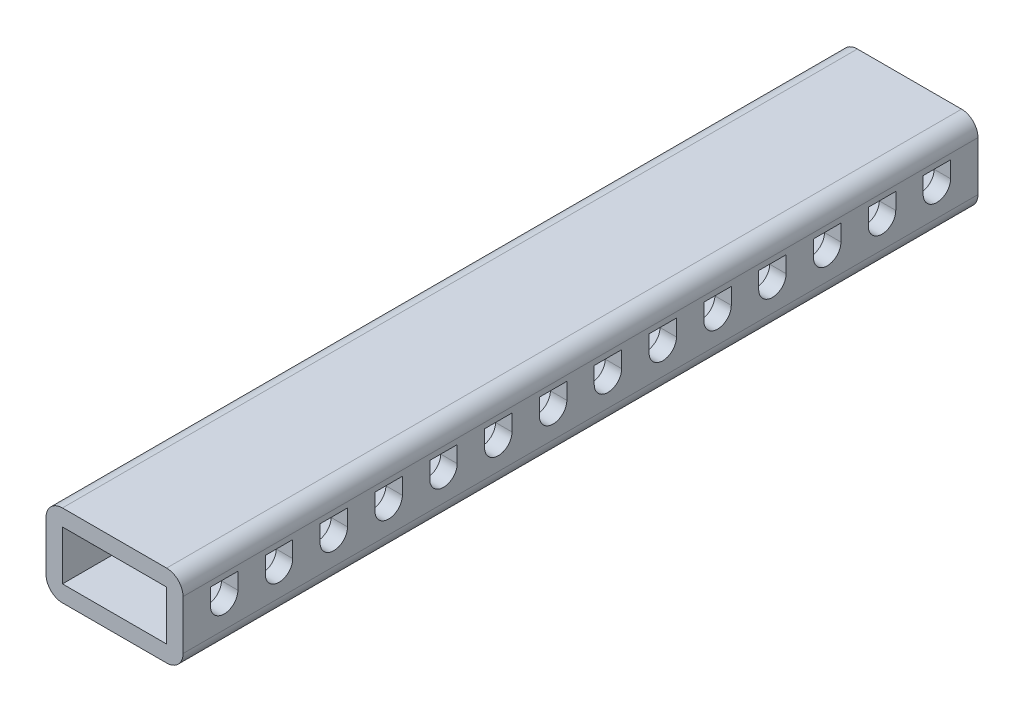
from build123d import *

# Parameters (mm, degrees)
SKETCH1_W           = 25
SKETCH1_H           = 15
BOSS_EXTRUDE1_DEPTH = 145
SKETCH2_W           = 19
SKETCH2_H           = 9
CUT_EXTRUDE1_DEPTH  = 263
CUT_EXTRUDE2_DEPTH  = 263
FILLET1_R           = 3


with BuildPart() as part:
    # Sketch1 → Boss-Extrude1 (new body)
    with BuildSketch(Plane.XY):
        Rectangle(SKETCH1_W, SKETCH1_H)
    extrude(amount=BOSS_EXTRUDE1_DEPTH)

    # Sketch2 → Cut-Extrude1 (cut)
    with BuildSketch(Plane.XY.offset(145)):
        Rectangle(SKETCH2_W, SKETCH2_H)
    extrude(amount=-CUT_EXTRUDE1_DEPTH, mode=Mode.SUBTRACT)

    # Sketch3 → Cut-Extrude2 (cut)
    with BuildSketch(Plane(origin=(12.5, 0, 0), x_dir=(0, 0, -1), z_dir=(1, 0, 0))):
        with BuildLine():
            Line((-140, 3.5), (-140, 0.5))
            ThreePointArc((-140, 0.5), (-137.5, -2), (-135, 0.5))
            Line((-135, 0.5), (-135, 3.5))
            Line((-135, 3.5), (-140, 3.5))
        make_face()
        with BuildLine():
            ThreePointArc((-125, 0.5), (-127.5, -2), (-130, 0.5))
            Line((-130, 0.5), (-130, 3.5))
            Line((-130, 3.5), (-125, 3.5))
            Line((-125, 3.5), (-125, 0.5))
        make_face()
        with BuildLine():
            Line((-120, 3.5), (-120, 0.5))
            ThreePointArc((-120, 0.5), (-117.5, -2), (-115, 0.5))
            Line((-115, 0.5), (-115, 3.5))
            Line((-115, 3.5), (-120, 3.5))
        make_face()
        with BuildLine():
            ThreePointArc((-105, 0.5), (-107.5, -2), (-110, 0.5))
            Line((-110, 0.5), (-110, 3.5))
            Line((-110, 3.5), (-105, 3.5))
            Line((-105, 3.5), (-105, 0.5))
        make_face()
        with BuildLine():
            Line((-100, 3.5), (-100, 0.5))
            ThreePointArc((-100, 0.5), (-97.5, -2), (-95, 0.5))
            Line((-95, 0.5), (-95, 3.5))
            Line((-95, 3.5), (-100, 3.5))
        make_face()
        with BuildLine():
            ThreePointArc((-85, 0.5), (-87.5, -2), (-90, 0.5))
            Line((-90, 0.5), (-90, 3.5))
            Line((-90, 3.5), (-85, 3.5))
            Line((-85, 3.5), (-85, 0.5))
        make_face()
        with BuildLine():
            Line((-80, 3.5), (-80, 0.5))
            ThreePointArc((-80, 0.5), (-77.5, -2), (-75, 0.5))
            Line((-75, 0.5), (-75, 3.5))
            Line((-75, 3.5), (-80, 3.5))
        make_face()
        with BuildLine():
            ThreePointArc((-65, 0.5), (-67.5, -2), (-70, 0.5))
            Line((-70, 0.5), (-70, 3.5))
            Line((-70, 3.5), (-65, 3.5))
            Line((-65, 3.5), (-65, 0.5))
        make_face()
        with BuildLine():
            Line((-60, 3.5), (-60, 0.5))
            ThreePointArc((-60, 0.5), (-57.5, -2), (-55, 0.5))
            Line((-55, 0.5), (-55, 3.5))
            Line((-55, 3.5), (-60, 3.5))
        make_face()
        with BuildLine():
            ThreePointArc((-45, 0.5), (-47.5, -2), (-50, 0.5))
            Line((-50, 0.5), (-50, 3.5))
            Line((-50, 3.5), (-45, 3.5))
            Line((-45, 3.5), (-45, 0.5))
        make_face()
        with BuildLine():
            Line((-40, 3.5), (-40, 0.5))
            ThreePointArc((-40, 0.5), (-37.5, -2), (-35, 0.5))
            Line((-35, 0.5), (-35, 3.5))
            Line((-35, 3.5), (-40, 3.5))
        make_face()
        with BuildLine():
            ThreePointArc((-25, 0.5), (-27.5, -2), (-30, 0.5))
            Line((-30, 0.5), (-30, 3.5))
            Line((-30, 3.5), (-25, 3.5))
            Line((-25, 3.5), (-25, 0.5))
        make_face()
        with BuildLine():
            Line((-20, 3.5), (-20, 0.5))
            ThreePointArc((-20, 0.5), (-17.5, -2), (-15, 0.5))
            Line((-15, 0.5), (-15, 3.5))
            Line((-15, 3.5), (-20, 3.5))
        make_face()
        with BuildLine():
            ThreePointArc((-5, 0.5), (-7.5, -2), (-10, 0.5))
            Line((-10, 0.5), (-10, 3.5))
            Line((-10, 3.5), (-5, 3.5))
            Line((-5, 3.5), (-5, 0.5))
        make_face()
        with BuildLine():
            Line((0, 3.5), (0, 0.5))
            ThreePointArc((0, 0.5), (2.5, -2), (5, 0.5))
            Line((5, 0.5), (5, 3.5))
            Line((5, 3.5), (0, 3.5))
        make_face()
        with BuildLine():
            ThreePointArc((15, 0.5), (12.5, -2), (10, 0.5))
            Line((10, 0.5), (10, 3.5))
            Line((10, 3.5), (15, 3.5))
            Line((15, 3.5), (15, 0.5))
        make_face()
        with BuildLine():
            Line((20, 3.5), (20, 0.5))
            ThreePointArc((20, 0.5), (22.5, -2), (25, 0.5))
            Line((25, 0.5), (25, 3.5))
            Line((25, 3.5), (20, 3.5))
        make_face()
        with BuildLine():
            ThreePointArc((35, 0.5), (32.5, -2), (30, 0.5))
            Line((30, 0.5), (30, 3.5))
            Line((30, 3.5), (35, 3.5))
            Line((35, 3.5), (35, 0.5))
        make_face()
        with BuildLine():
            Line((40, 3.5), (40, 0.5))
            ThreePointArc((40, 0.5), (42.5, -2), (45, 0.5))
            Line((45, 0.5), (45, 3.5))
            Line((45, 3.5), (40, 3.5))
        make_face()
        with BuildLine():
            ThreePointArc((55, 0.5), (52.5, -2), (50, 0.5))
            Line((50, 0.5), (50, 3.5))
            Line((50, 3.5), (55, 3.5))
            Line((55, 3.5), (55, 0.5))
        make_face()
        with BuildLine():
            Line((60, 3.5), (60, 0.5))
            ThreePointArc((60, 0.5), (62.5, -2), (65, 0.5))
            Line((65, 0.5), (65, 3.5))
            Line((65, 3.5), (60, 3.5))
        make_face()
        with BuildLine():
            ThreePointArc((75, 0.5), (72.5, -2), (70, 0.5))
            Line((70, 0.5), (70, 3.5))
            Line((70, 3.5), (75, 3.5))
            Line((75, 3.5), (75, 0.5))
        make_face()
    extrude(amount=-CUT_EXTRUDE2_DEPTH, mode=Mode.SUBTRACT)

    # Fillet1
    fillet1_edges = [part.edges().sort_by_distance(p)[0] for p in [
        (12.5, -7.5, 72.5),
        (-12.5, -7.5, 72.5),
        (-12.5, 7.5, 72.5),
        (12.5, 7.5, 72.5),
    ]]
    fillet(fillet1_edges, radius=FILLET1_R)


solid = part.part
